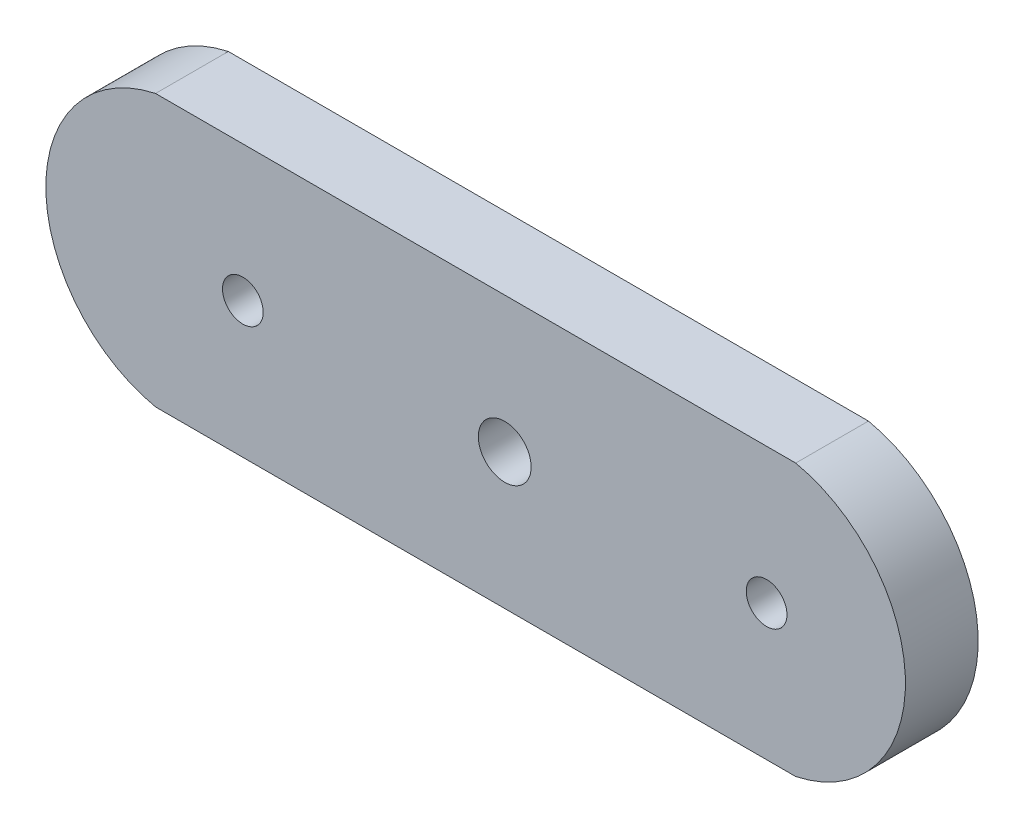
from build123d import *

# Parameters (mm, degrees)
SKETCH9_R           = 2.305
SKETCH9_R_2         = 1.778
BOSS_EXTRUDE1_DEPTH = 6.35


with BuildPart() as part:
    # Sketch9 → Boss-Extrude1 (new body)
    with BuildSketch(Plane.XY):
        with BuildLine():
            Line((19.05, 0), (69.85, 0))
            ThreePointArc((69.85, 0), (79.428440233, 11.849261314), (69.85, 23.698522628))
            Line((69.85, 23.698522628), (19.05, 23.698522628))
            Line((19.05, 23.698522628), (13.97, 23.698522628))
            ThreePointArc((13.97, 23.698522628), (4.391559767, 11.849261314), (13.97, 0))
            Line((13.97, 0), (19.05, 0))
        make_face()
        with Locations((44.45, 11.849261314)):
            Circle(SKETCH9_R, mode=Mode.SUBTRACT)
        with Locations((67.31, 11.849261314)):
            Circle(SKETCH9_R_2, mode=Mode.SUBTRACT)
        with Locations((21.59, 11.849261314)):
            Circle(SKETCH9_R_2, mode=Mode.SUBTRACT)
    extrude(amount=BOSS_EXTRUDE1_DEPTH)


solid = part.part
